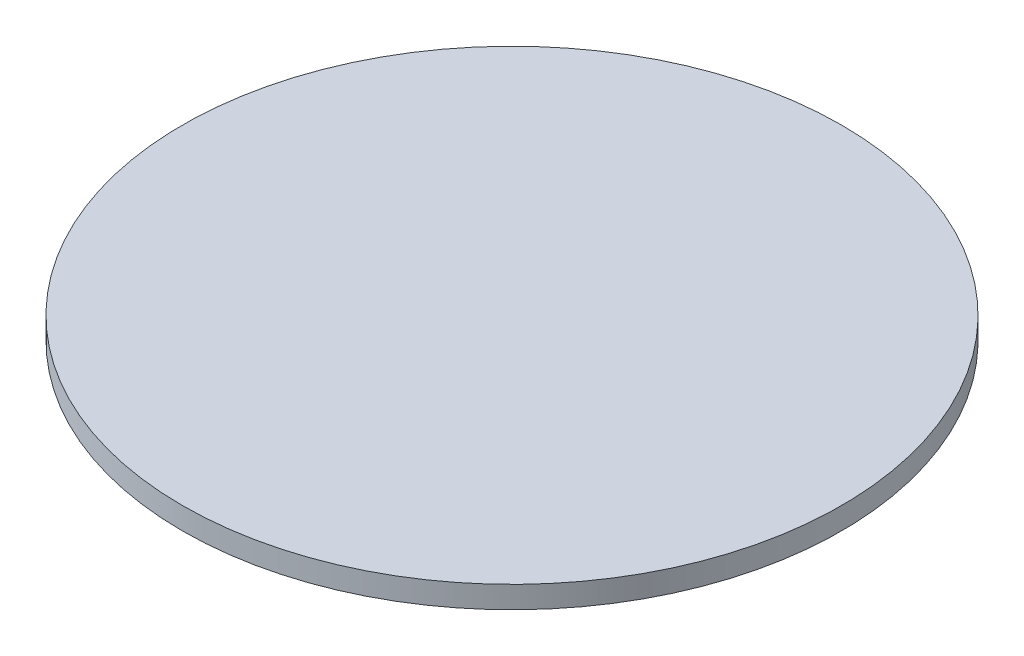
from build123d import *

# Parameters (mm, degrees)
SKETCH1_R           = 95.123
BOSS_EXTRUDE1_DEPTH = 6.35


with BuildPart() as part:
    # Sketch1 → Boss-Extrude1 (new body)
    with BuildSketch(Plane(origin=(0, 0, 0), x_dir=(1, 0, 0), z_dir=(0, 1, 0))):
        with Locations(Location((0, 0, 0), (0, 0, 270))):
            Circle(SKETCH1_R)
    extrude(amount=BOSS_EXTRUDE1_DEPTH)


solid = part.part
